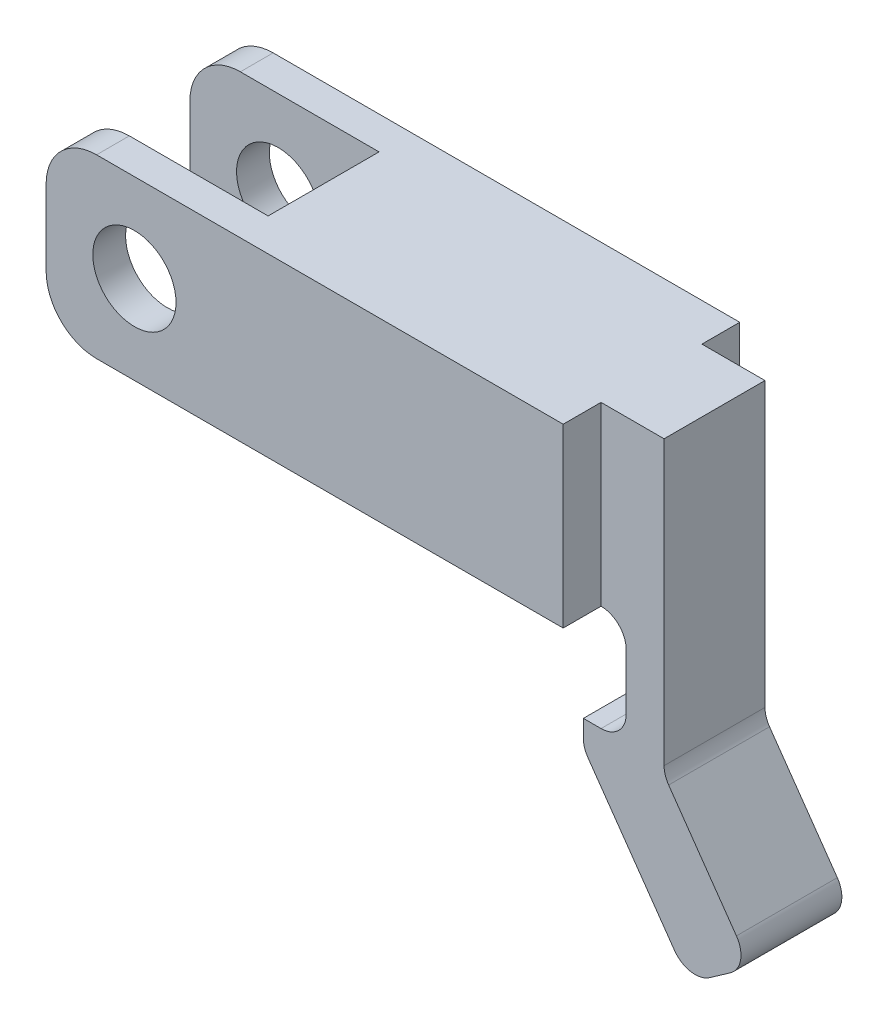
from build123d import *

# Parameters (mm, degrees)
SKETCH1_W           = 13
SKETCH1_H           = 7
BOSS_EXTRUDE1_DEPTH = 3.5
SKETCH3_W           = 7.5
SKETCH3_H           = 7
BOSS_EXTRUDE2_DEPTH = 1.3
CUT_EXTRUDE2_REACH  = 18.039
SKETCH4_R           = 1.65
FILLET3_R           = 0.7
FILLET4_R           = 2
BOSS_EXTRUDE4_DEPTH = 2
FILLET5_R           = 1


with BuildPart() as part:
    # Sketch1 → Boss-Extrude1 (new, symmetric)
    with BuildSketch(Plane.XY):
        Rectangle(SKETCH1_W, SKETCH1_H)
    extrude(amount=BOSS_EXTRUDE1_DEPTH, both=True)

    # Sketch3 → Boss-Extrude2 (add)
    with BuildSketch(Plane.XY.offset(3.5)):
        with Locations((-10.25, 0)):
            Rectangle(SKETCH3_W, SKETCH3_H)
    boss_extrude2 = extrude(amount=-BOSS_EXTRUDE2_DEPTH)

    # Sketch4 → Cut-Extrude2 (cut, up to next)
    with BuildSketch(Plane.XY.offset(3.5), mode=Mode.PRIVATE) as cut_extrude2_sk1:
        with Locations((-10.5, 0)):
            Circle(SKETCH4_R)
    cut_extrude2_tool1 = extrude(cut_extrude2_sk1.sketch, amount=-CUT_EXTRUDE2_REACH, mode=Mode.PRIVATE) & part.part
    cut_extrude2 = cut_extrude2_tool1.solids().sort_by_distance((-10.5, 0, 3.5))[0]
    add(cut_extrude2, mode=Mode.SUBTRACT)

    # Mirror1: Boss-Extrude2, Cut-Extrude2 across plane
    add(boss_extrude2.mirror(Plane.XY))
    add(cut_extrude2.mirror(Plane.XY), mode=Mode.SUBTRACT)

    # Fillet3
    fillet3_edges = [part.edges().sort_by_distance(p)[0] for p in [
        (-6.5, -3.5, 0),
    ]]
    fillet(fillet3_edges, radius=FILLET3_R)

    # Fillet4
    fillet4_edges = [part.edges().sort_by_distance(p)[0] for p in [
        (-14, -3.5, 2.85),
        (-14, 3.5, 2.85),
        (-14, 3.5, -2.85),
        (-14, -3.5, -2.85),
    ]]
    fillet(fillet4_edges, radius=FILLET4_R)

    # Sketch6 → Boss-Extrude4 (add, symmetric)
    with BuildSketch(Plane.XY):
        Polygon((6.5, 3.5), (9, 3.5), (9, -8.039733235), (12.441458618, -12.9546455), (9.984002485, -14.675374809), (5.8, -8.7), (5.8, -7.7), (7.5, -7.7), (7.5, -3.5), (6.5, -3.5), align=None)
    extrude(amount=BOSS_EXTRUDE4_DEPTH, both=True)

    # Fillet5
    fillet5_edges = [part.edges().sort_by_distance(p)[0] for p in [
        (7.5, -3.5, 0),
        (7.5, -7.7, 0),
        (5.8, -8.7, 0),
        (9.984002485, -14.675374809, 0),
        (12.441458618, -12.9546455, 0),
        (9, -8.039733235, 0),
    ]]
    fillet(fillet5_edges, radius=FILLET5_R)


solid = part.part
